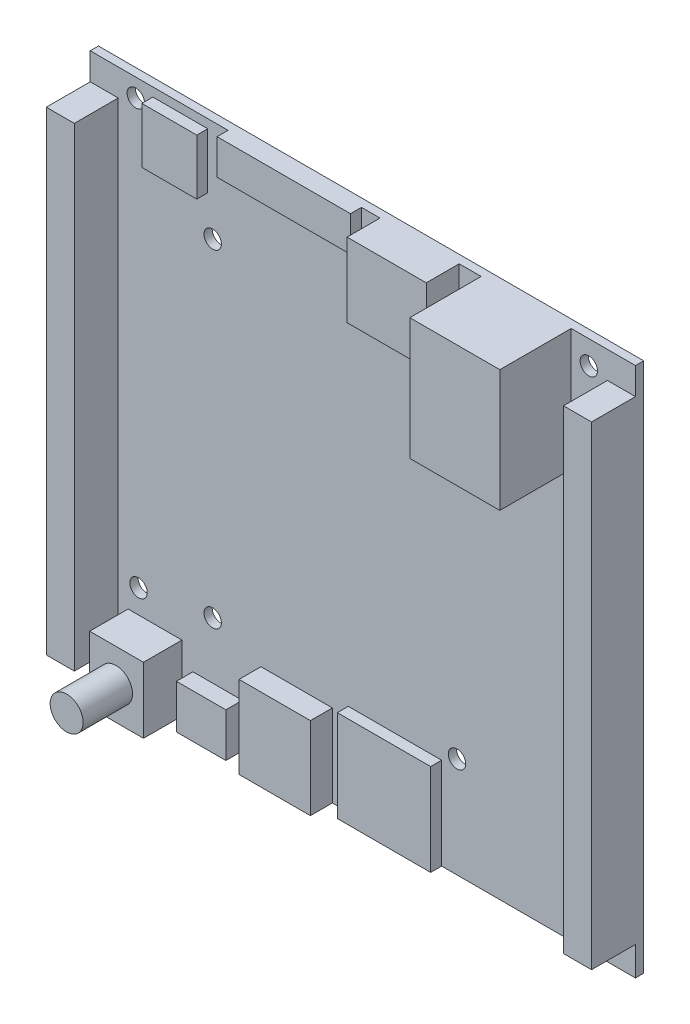
from build123d import *

# Parameters (mm, degrees)
SKETCH_1_W       = 99.3
SKETCH_1_H       = 96.6
SKETCH_1_R       = 1.585
EXTRUDE_1_DEPTH  = 1.5
SKETCH_2_W       = 9.8
SKETCH_2_H       = 12
EXTRUDE_2_DEPTH  = 7
SKETCH_3_R       = 3
EXTRUDE_3_DEPTH  = 9
SKETCH_4_W       = 5.1
SKETCH_4_H       = 86.4
EXTRUDE_4_DEPTH  = 8
SKETCH_5_W       = 16.4
SKETCH_5_H       = 22.2
EXTRUDE_5_DEPTH  = 13
SKETCH_6_W       = 14.42
SKETCH_6_H       = 13.5
EXTRUDE_6_DEPTH  = 6
SKETCH_7_W       = 24.3
SKETCH_7_H       = 6.4
EXTRUDE_7_DEPTH  = 2
SKETCH_8_W       = 10
SKETCH_8_H       = 10.1
EXTRUDE_8_DEPTH  = 2
SKETCH_9_W       = 9
SKETCH_9_H       = 8
EXTRUDE_9_DEPTH  = 3
SKETCH_10_W      = 13
SKETCH_10_H      = 15
EXTRUDE_10_DEPTH = 4
SKETCH_11_W      = 17
SKETCH_11_H      = 16.7
EXTRUDE_11_DEPTH = 2


with BuildPart() as part:
    # 草图1 → 凸台-拉伸1 (new body)
    with BuildSketch(Plane.XY):
        with Locations((31.77, 34.42)):
            Rectangle(SKETCH_1_W, SKETCH_1_H)
        with Locations((48.92, 64.16)):
            Circle(SKETCH_1_R, mode=Mode.SUBTRACT)
        with Locations((4.42, 64.16)):
            Circle(SKETCH_1_R, mode=Mode.SUBTRACT)
        with Locations((4.42, 4.42)):
            Circle(SKETCH_1_R, mode=Mode.SUBTRACT)
        with Locations((48.92, 4.42)):
            Circle(SKETCH_1_R, mode=Mode.SUBTRACT)
        with Locations((-9.08, 2.42)):
            Circle(SKETCH_1_R, mode=Mode.SUBTRACT)
        with Locations((72.92, -9.58)):
            Circle(SKETCH_1_R, mode=Mode.SUBTRACT)
        with Locations((72.92, 78.42)):
            Circle(SKETCH_1_R, mode=Mode.SUBTRACT)
        with Locations((-9.58, 79.42)):
            Circle(SKETCH_1_R, mode=Mode.SUBTRACT)
    extrude(amount=EXTRUDE_1_DEPTH)

    # 草图2 → 凸台-拉伸2 (add)
    with BuildSketch(Plane.XY.offset(1.5)):
        with Locations((-6.08, -7.88)):
            Rectangle(SKETCH_2_W, SKETCH_2_H)
    extrude(amount=EXTRUDE_2_DEPTH)

    # 草图3 → 凸台-拉伸3 (add)
    with BuildSketch(Plane.XY.offset(8.5)):
        with Locations((-6.18, -7.88)):
            Circle(SKETCH_3_R)
    extrude(amount=EXTRUDE_3_DEPTH)

    # 草图4 → 凸台-拉伸4 (add)
    with BuildSketch(Plane.XY.offset(1.5)):
        with Locations((78.87, 34.62)):
            Rectangle(SKETCH_4_W, SKETCH_4_H)
        with Locations((-15.33, 34.62)):
            Rectangle(SKETCH_4_W, SKETCH_4_H)
    extrude(amount=EXTRUDE_4_DEPTH)

    # 草图5 → 凸台-拉伸5 (add)
    with BuildSketch(Plane.XY.offset(1.5)):
        with Locations((61.52, 71.62)):
            Rectangle(SKETCH_5_W, SKETCH_5_H)
    extrude(amount=EXTRUDE_5_DEPTH)

    # 草图6 → 凸台-拉伸6 (add)
    with BuildSketch(Plane.XY.offset(1.5)):
        with Locations((42.11, 75.97)):
            Rectangle(SKETCH_6_W, SKETCH_6_H)
    extrude(amount=EXTRUDE_6_DEPTH)

    # 草图7 → 凸台-拉伸7 (add)
    with BuildSketch(Plane.XY.offset(1.5)):
        with Locations((19.37, 79.52)):
            Rectangle(SKETCH_7_W, SKETCH_7_H)
    extrude(amount=EXTRUDE_7_DEPTH)

    # 草图8 → 凸台-拉伸8 (add)
    with BuildSketch(Plane.XY.offset(1.5)):
        with Locations((-1.48, 76.07)):
            Rectangle(SKETCH_8_W, SKETCH_8_H)
    extrude(amount=EXTRUDE_8_DEPTH)

    # 草图9 → 凸台-拉伸9 (add)
    with BuildSketch(Plane.XY.offset(1.5)):
        with Locations((5.32, -9.88)):
            Rectangle(SKETCH_9_W, SKETCH_9_H)
    extrude(amount=EXTRUDE_9_DEPTH)

    # 草图10 → 凸台-拉伸10 (add)
    with BuildSketch(Plane.XY.offset(1.5)):
        with Locations((19.72, -6.38)):
            Rectangle(SKETCH_10_W, SKETCH_10_H)
    extrude(amount=EXTRUDE_10_DEPTH)

    # 草图11 → 凸台-拉伸11 (add)
    with BuildSketch(Plane.XY.offset(1.5)):
        with Locations((37.62, -5.53)):
            Rectangle(SKETCH_11_W, SKETCH_11_H)
    extrude(amount=EXTRUDE_11_DEPTH)


solid = part.part
